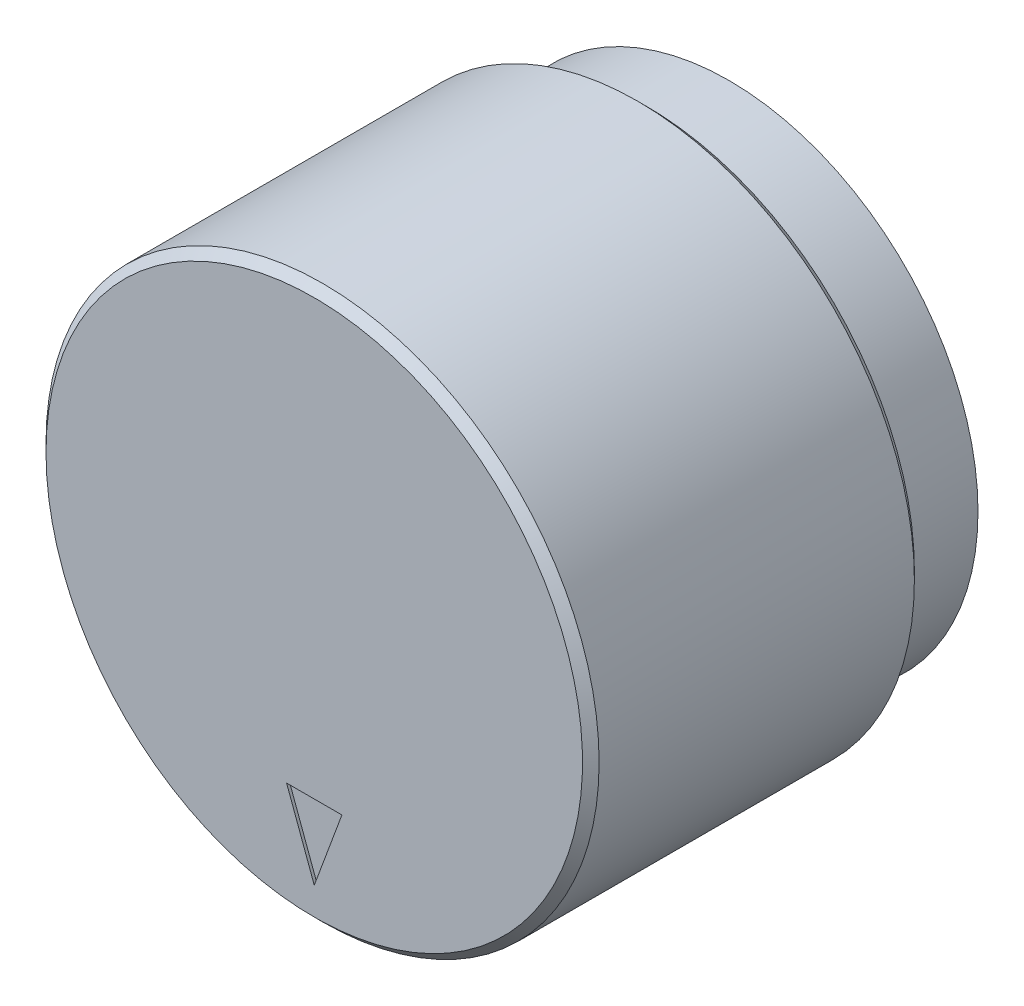
from build123d import *

# Parameters (mm, degrees)
SKETCH1_R           = 10
BOSS_EXTRUDE1_DEPTH = 12
SKETCH2_R           = 9
SKETCH2_R_2         = 8
BOSS_EXTRUDE2_DEPTH = 3
SKETCH3_R           = 3
CUT_EXTRUDE1_DEPTH  = 10
CHAMFER1_SIZE       = 0.3
CUT_EXTRUDE2_DEPTH  = 0.1


with BuildPart() as part:
    # Sketch1 → Boss-Extrude1 (new body)
    with BuildSketch(Plane(origin=(0, 0, 0), x_dir=(0, 1, 0), z_dir=(0, 0, 1))):
        with Locations(Location((0, 0, 0), (0, 0, 270))):
            Circle(SKETCH1_R)
    extrude(amount=BOSS_EXTRUDE1_DEPTH)

    # Sketch2 → Boss-Extrude2 (add)
    with BuildSketch(Plane(origin=(0, 0, 0), x_dir=(1, 0, 0), z_dir=(0, 0, -1))):
        Circle(SKETCH2_R)
        with Locations(Location((0, 0, 0), (0, 0, 180))):
            Circle(SKETCH2_R_2, mode=Mode.SUBTRACT)
    extrude(amount=BOSS_EXTRUDE2_DEPTH)

    # Sketch3 → Cut-Extrude1 (cut)
    with BuildSketch(Plane(origin=(0, 0, 0), x_dir=(1, 0, 0), z_dir=(0, 0, -1))):
        with Locations(Location((0, 0, 0), (0, 0, 180))):
            Circle(SKETCH3_R)
    extrude(amount=-CUT_EXTRUDE1_DEPTH, mode=Mode.SUBTRACT)

    # Chamfer1
    chamfer1_edges = [part.edges().sort_by_distance(p)[0] for p in [
        (-10, 0, 0),
        (-10, 0, 12),
    ]]
    chamfer(chamfer1_edges, length=CHAMFER1_SIZE)

    # Sketch4 → Cut-Extrude2 (cut)
    with BuildSketch(Plane.XY.offset(12)):
        Polygon((-1, -6), (1, -6), (0, -8.7), align=None)
    extrude(amount=-CUT_EXTRUDE2_DEPTH, mode=Mode.SUBTRACT)


solid = part.part
